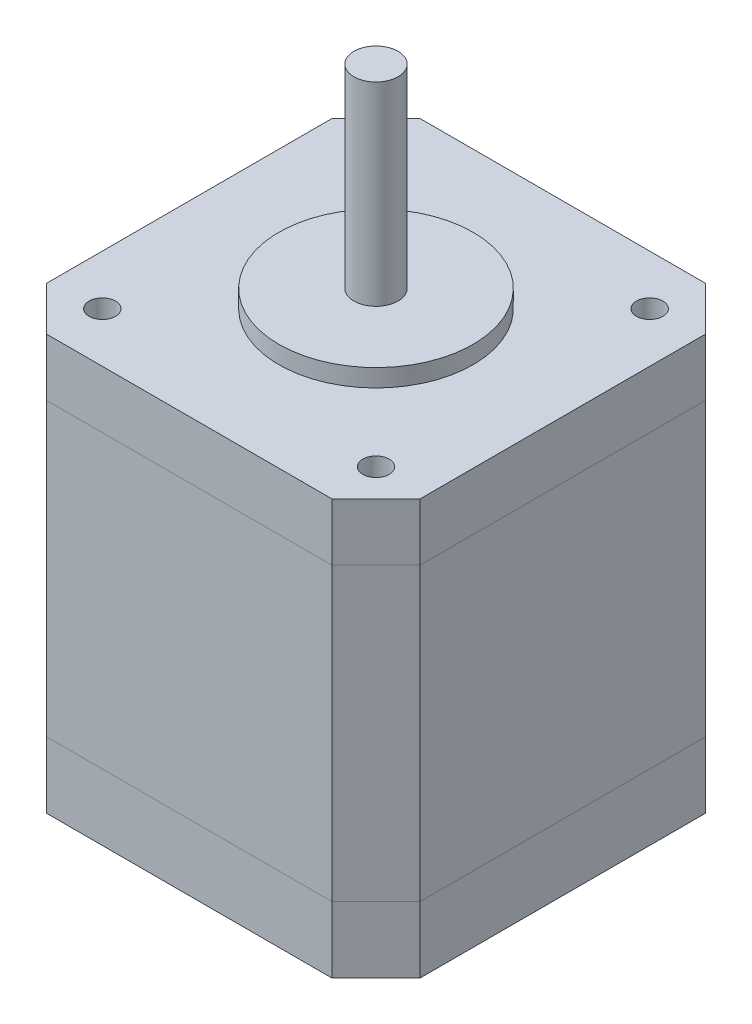
from build123d import *

# Parameters (mm, degrees)
EXTRUDE1_DEPTH      = 47
SKETCH2_R           = 11
EXTRUDE2_DEPTH      = 2
EXTRUDE3_START      = -9.5
SKETCH3_R           = 2.5
EXTRUDE3_DEPTH      = 80.5
SKETCH4_R           = 1.5
EXTRUDE4_DEPTH      = 4.5
CUT_EXTRUDE_3_DEPTH = 33
EXTRUDE_4_DEPTH     = 33


with BuildPart() as part:
    # Sketch1 → Extrude1 (new body)
    with BuildSketch(Plane(origin=(0, 0, 0), x_dir=(1, 0, 0), z_dir=(0, 1, 0))):
        Polygon((16.15, 21.15), (21.15, 16.15), (21.15, -16.15), (16.15, -21.15), (-16.15, -21.15), (-21.15, -16.15), (-21.15, 16.15), (-16.15, 21.15), align=None)
    extrude(amount=EXTRUDE1_DEPTH)

    # Sketch2 → Extrude2 (add)
    with BuildSketch(Plane(origin=(0, 47, 0), x_dir=(1, 0, 0), z_dir=(0, 1, 0))):
        with Locations(Location((0, 0, 0), (0, 0, 90))):
            Circle(SKETCH2_R)
    extrude(amount=EXTRUDE2_DEPTH)

    # Sketch3 → Extrude3 (add)
    with BuildSketch(Plane(origin=(0, 0, 0), x_dir=(1, 0, 0), z_dir=(0, 1, 0)).offset(EXTRUDE3_START)):
        with Locations(Location((0, 0, 0), (0, 0, 270))):
            Circle(SKETCH3_R)
    extrude(amount=EXTRUDE3_DEPTH)

    # Sketch4 → Extrude4 (cut)
    with BuildSketch(Plane(origin=(0, 47, 0), x_dir=(1, 0, 0), z_dir=(0, 1, 0))):
        with Locations(Location((-15.5, 15.5, 0), (0, 0, 270))):
            Circle(SKETCH4_R)
        with Locations(Location((15.5, 15.5, 0), (0, 0, 270))):
            Circle(SKETCH4_R)
        with Locations(Location((-15.5, -15.5, 0), (0, 0, 270))):
            Circle(SKETCH4_R)
        with Locations(Location((15.5, -15.5, 0), (0, 0, 270))):
            Circle(SKETCH4_R)
    extrude(amount=-EXTRUDE4_DEPTH, mode=Mode.SUBTRACT)

    # Эскиз2 → Вытянуть3 (cut)
    with BuildSketch(Plane.XZ.offset(-7.5)):
        Polygon((-21.15, 16.15), (-16.15, 21.15), (16.15, 21.15), (21.15, 16.15), (21.15, -16.15), (16.15, -21.15), (-16.15, -21.15), (-21.15, -16.15), align=None)
    extrude(amount=-CUT_EXTRUDE_3_DEPTH, mode=Mode.SUBTRACT)


with BuildPart() as cut_extrude_3_piece_1:
    # of the separate pieces the step leaves, piece 1, a body of its own (cut_extrude_3_pieces)
    add(part.part.solids().sort_by_distance((16.15, 0, -21.15))[0])


with BuildPart() as cut_extrude_3_piece_2:
    # of the separate pieces the step leaves, piece 2, a body of its own (cut_extrude_3_pieces)
    add(part.part.solids().sort_by_distance((21.15, 40.5, -16.15))[0])


with BuildPart() as body_3:
    # Эскиз3 → Вытянуть4 (new body)
    with BuildSketch(Plane.XZ.offset(-7.5)):
        Polygon((-21.15, 16.15), (-16.15, 21.15), (16.15, 21.15), (21.15, 16.15), (21.15, -16.15), (16.15, -21.15), (-16.15, -21.15), (-21.15, -16.15), align=None)
    extrude(amount=-EXTRUDE_4_DEPTH)


solid = Compound([cut_extrude_3_piece_1.part, cut_extrude_3_piece_2.part, body_3.part])
